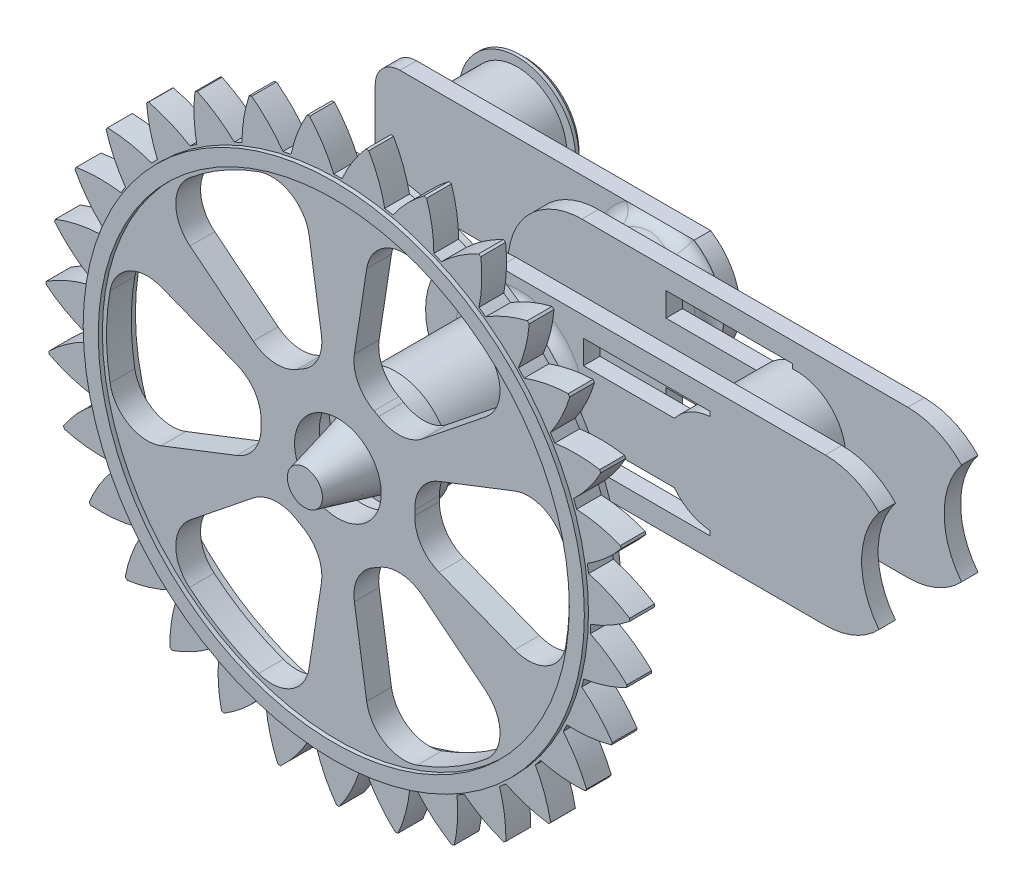
from build123d import *

# Parameters (mm, degrees)
ESQUISSE1_W                  = 1.535660627
ESQUISSE1_H                  = 0.289581718
BOSS_EXTRU_1_DEPTH           = 0.2
ESQUISSE1_3_R                = 0.6
BOSS_EXTRU_2_DEPTH           = 1.9
ESQUISSE1_4_R                = 0.6
BOSS_EXTRU_3_DEPTH           = 0.8
R_P_TITION_LIN_AIRE1_COUNT   = 2
R_P_TITION_LIN_AIRE1_PITCH   = 1
BOSS_EXTRU_4_START           = 0.5
ESQUISSE2_R                  = 0.6
BOSS_EXTRU_4_DEPTH           = 0.5
BOSS_EXTRU_5_DEPTH           = 0.2
ESQUISSE3_3_R                = 0.6
BOSS_EXTRU_6_DEPTH           = 0.8
ESQUISSE4_R                  = 0.706244544
BOSS_EXTRU_7_DEPTH           = 0.1
CHANFREIN1_SIZE              = 0.06
CONG_1_R                     = 0.17
BOSS_EXTRU_8_DEPTH           = 0.2
BOSS_EXTRU_8_DEPTH_BACK      = 0.2
ESQUISSE5_R                  = 0.66792824
ESQUISSE5_R_2                = 0.6
ESQUISSE6_W                  = 1.29816194
ESQUISSE6_H                  = 0.8
ENL_V_MAT_EXTRU_1_DEPTH      = 2.9
ESQUISSE7_R                  = 0.6
BOSS_EXTRU_9_DEPTH           = 1.1
ESQUISSE8_R                  = 3.540504545
ESQUISSE8_R_2                = 0.524870102
BOSS_EXTRU_10_DEPTH          = 0.3
ENL_V_MAT_EXTRU_2_DEPTH      = 0.3
R_P_TITION_CIRCULAIRE1_COUNT = 31
BOSS_EXTRU_11_DEPTH          = 0.1
BOSS_EXTRU_11_DEPTH_BACK     = 0.35
ESQUISSE10_R                 = 3.03621513
ESQUISSE10_R_2               = 2.853759062
ESQUISSE11_R                 = 0.387270858
BOSS_EXTRU_12_DEPTH          = 0.7
BOSS_EXTRU_12_DRAFT          = -14


with BuildPart() as part:
    # Esquisse1 → Boss.-Extru.1 (new body)
    with BuildSketch(Plane.XY):
        with BuildLine():
            ThreePointArc((1.348475238, 0.613657343), (1.052272365, 0.821028945), (0.69816194, 0.894137977))
            Line((0.69816194, 0.894137977), (-3.250686786, 0.894137977))
            ThreePointArc((-3.250686786, 0.894137977), (-4.144824763, 0), (-3.250686786, -0.894137977))
            Line((-3.250686786, -0.894137977), (0.69816194, -0.894137977))
            ThreePointArc((0.69816194, -0.894137977), (1.052272365, -0.821028945), (1.348475238, -0.613657343))
            ThreePointArc((1.348475238, -0.613657343), (1.138017125, 0), (1.348475238, 0.613657343))
        make_face()
        with Locations((-1.464318633, -0.508846585)):
            Rectangle(ESQUISSE1_W, ESQUISSE1_H, mode=Mode.SUBTRACT)
        with Locations((-1.464318633, 0.508846585)):
            Rectangle(ESQUISSE1_W, ESQUISSE1_H, mode=Mode.SUBTRACT)
    boss_extru_1 = extrude(amount=BOSS_EXTRU_1_DEPTH)

    # Esquisse1<3> → Boss.-Extru.2 (add)
    with BuildSketch(Plane.XY):
        with Locations((-3.007195488, 0)):
            Circle(ESQUISSE1_3_R)
    extrude(amount=BOSS_EXTRU_2_DEPTH)

    # Esquisse1<4> → Boss.-Extru.3 (add)
    with BuildSketch(Plane.XY):
        Circle(ESQUISSE1_4_R)
    extrude(amount=-BOSS_EXTRU_3_DEPTH)

    # Répétition linéaire1: Boss.-Extru.1 ×2
    with Locations(*[(0, 0, -i * R_P_TITION_LIN_AIRE1_PITCH) for i in range(1, R_P_TITION_LIN_AIRE1_COUNT)]):
        add(boss_extru_1)

    # Esquisse2 → Boss.-Extru.4 (add)
    with BuildSketch(Plane(origin=(0, 0, -1), x_dir=(-1, 0, 0), z_dir=(0, 0, -1)).offset(BOSS_EXTRU_4_START)):
        with Locations((3.007195488, 0)):
            Circle(ESQUISSE2_R)
    extrude(amount=-BOSS_EXTRU_4_DEPTH)

    # Esquisse3 → Boss.-Extru.5 (add)
    with BuildSketch(Plane(origin=(0, 0, -1.5), x_dir=(-1, 0, 0), z_dir=(0, 0, -1))):
        with BuildLine():
            Line((6.154794997, 0.653637444), (2.590715916, 0.653637444))
            ThreePointArc((2.590715916, 0.653637444), (2.232148952, 9.6719e-05), (2.590552792, -0.653533478))
            Line((2.590552792, -0.653533478), (6.154794997, -0.653533478))
            ThreePointArc((6.154794997, -0.653533478), (6.366927031, -0.565665513), (6.454794997, -0.353533478))
            Line((6.454794997, -0.353533478), (6.454794997, 0.353637444))
            ThreePointArc((6.454794997, 0.353637444), (6.366927031, 0.565769479), (6.154794997, 0.653637444))
        make_face()
    extrude(amount=BOSS_EXTRU_5_DEPTH)

    # Esquisse3<3> → Boss.-Extru.6 (add)
    with BuildSketch(Plane(origin=(0, 0, -1.5), x_dir=(-1, 0, 0), z_dir=(0, 0, -1))):
        with Locations((5.533341724, 0)):
            Circle(ESQUISSE3_3_R)
    extrude(amount=BOSS_EXTRU_6_DEPTH)

    # Esquisse4 → Boss.-Extru.7 (add)
    with BuildSketch(Plane(origin=(0, 0, -2.3), x_dir=(-1, 0, 0), z_dir=(0, 0, -1))):
        with Locations((5.533341724, 0)):
            Circle(ESQUISSE4_R)
    extrude(amount=BOSS_EXTRU_7_DEPTH)

    # Chanfrein1
    chanfrein1_edges = [part.edges().sort_by_distance(p)[0] for p in [
        (-4.82709718, 0, -2.4),
    ]]
    chamfer(chanfrein1_edges, length=CHANFREIN1_SIZE)

    # Congé1
    cong_1_edges = [part.edges().sort_by_distance(p)[0] for p in [
        (-2.407195488, 0, -1.5),
        (-2.407195488, 0, -1),
        (-3.607195488, 0, 0.2),
    ]]
    fillet(cong_1_edges, radius=CONG_1_R)

    # Esquisse5 → Boss.-Extru.8 (add, two sides: drawn at the far end of the back side and taken through both)
    with BuildSketch(Plane.XY.offset(1.9).offset(-BOSS_EXTRU_8_DEPTH_BACK)):
        with Locations((-3.007195488, 0)):
            Circle(ESQUISSE5_R)
        with Locations((-3.007195488, 0)):
            Circle(ESQUISSE5_R_2, mode=Mode.SUBTRACT)
    extrude(amount=BOSS_EXTRU_8_DEPTH + BOSS_EXTRU_8_DEPTH_BACK)

    # Esquisse6 → Enlèv. mat.-Extru.1 (cut)
    with BuildSketch(Plane(origin=(0, 0.894137977, 0), x_dir=(1, 0, 0), z_dir=(0, 1, 0))):
        with Locations((0.04908097, 0.4)):
            Rectangle(ESQUISSE6_W, ESQUISSE6_H)
    extrude(amount=-ENL_V_MAT_EXTRU_1_DEPTH, mode=Mode.SUBTRACT)


with BuildPart() as enl_v_mat_extru_1_piece_1:
    # of the separate pieces the step leaves, piece 1, a body of its own (enl_v_mat_extru_1_pieces)
    add(part.part.solids().sort_by_distance((-3.414206656, 0.653637444, -1.5))[0])



with BuildPart() as enl_v_mat_extru_1_piece_2:
    # of the separate pieces the step leaves, piece 2, a body of its own (enl_v_mat_extru_1_pieces)
    add(part.part.solids().sort_by_distance((0.69816194, -0.894137977, 0))[0])


with BuildPart() as enl_v_mat_extru_1_piece_1_1:
    add(enl_v_mat_extru_1_piece_1.part)

    add(enl_v_mat_extru_1_piece_2.part)  # Boss.-Extru.9 merges Enlèv. mat.-Extru.1 piece 2
    # Esquisse7 → Boss.-Extru.9 (add)
    with BuildSketch(Plane.XY.offset(0.2)):
        with Locations((-0.653226005, 0)):
            Circle(ESQUISSE7_R)
    extrude(amount=-BOSS_EXTRU_9_DEPTH)

    # Esquisse8 → Boss.-Extru.10 (add)
    with BuildSketch(Plane.XY.offset(2.1)):
        with Locations((-3.007195488, 0)):
            Circle(ESQUISSE8_R)
        with Locations((-3.007195488, 0)):
            Circle(ESQUISSE8_R_2, mode=Mode.SUBTRACT)
        with BuildLine():
            Line((-2.658268304, 2.270829461), (-2.807547224, 1.299317394))
            ThreePointArc((-2.807547224, 1.299317394), (-2.764117443, 1.023332989), (-2.568994459, 0.823381597))
            ThreePointArc((-2.568994459, 0.823381597), (-2.540832594, 0.807764227), (-2.513226623, 0.791184021))
            ThreePointArc((-2.513226623, 0.791184021), (-2.242502146, 0.722178256), (-1.981777749, 0.822559165))
            Line((-1.981777749, 0.822559165), (-1.215063079, 1.437594536))
            ThreePointArc((-1.215063079, 1.437594536), (-1.042922804, 1.791569296), (-1.207569078, 2.149091338))
            ThreePointArc((-1.207569078, 2.149091338), (-1.605656263, 2.427537146), (-2.045841, 2.633067858))
            ThreePointArc((-2.045841, 2.633067858), (-2.437787307, 2.596894693), (-2.658268304, 2.270829461))
        make_face(mode=Mode.SUBTRACT)
        with BuildLine():
            Line((-3.356122672, 2.270829461), (-3.206843752, 1.299317394))
            ThreePointArc((-3.206843752, 1.299317394), (-3.250273533, 1.023332989), (-3.445396517, 0.823381597))
            ThreePointArc((-3.445396517, 0.823381597), (-3.473558382, 0.807764227), (-3.501164353, 0.791184021))
            ThreePointArc((-3.501164353, 0.791184021), (-3.77188883, 0.722178256), (-4.032613227, 0.822559165))
            Line((-4.032613227, 0.822559165), (-4.799327897, 1.437594536))
            ThreePointArc((-4.799327897, 1.437594536), (-4.971468172, 1.791569296), (-4.806821899, 2.149091338))
            ThreePointArc((-4.806821899, 2.149091338), (-4.408734713, 2.427537146), (-3.968549976, 2.633067858))
            ThreePointArc((-3.968549976, 2.633067858), (-3.576603669, 2.596894693), (-3.356122672, 2.270829461))
        make_face(mode=Mode.SUBTRACT)
        with BuildLine():
            Line((-0.866135895, 0.833234925), (-1.782129485, 0.476758229))
            ThreePointArc((-1.782129485, 0.476758229), (-1.999424101, 0.301154732), (-2.075025594, 0.032197575))
            ThreePointArc((-2.075025594, 0.032197575), (-2.0744697, 0), (-2.075025594, -0.032197575))
            ThreePointArc((-2.075025594, -0.032197575), (-1.999424101, -0.301154732), (-1.782129485, -0.476758229))
            Line((-1.782129485, -0.476758229), (-0.866135895, -0.833234925))
            ThreePointArc((-0.866135895, -0.833234925), (-0.473514623, -0.805325396), (-0.246214589, -0.48397652))
            ThreePointArc((-0.246214589, -0.48397652), (-0.204117038, 0), (-0.246214589, 0.48397652))
            ThreePointArc((-0.246214589, 0.48397652), (-0.473514623, 0.805325396), (-0.866135895, 0.833234925))
        make_face(mode=Mode.SUBTRACT)
        with BuildLine():
            Line((-1.215063079, -1.437594536), (-1.981777749, -0.822559165))
            ThreePointArc((-1.981777749, -0.822559165), (-2.242502146, -0.722178256), (-2.513226623, -0.791184021))
            ThreePointArc((-2.513226623, -0.791184021), (-2.540832594, -0.807764227), (-2.568994459, -0.823381597))
            ThreePointArc((-2.568994459, -0.823381597), (-2.764117443, -1.023332989), (-2.807547224, -1.299317394))
            Line((-2.807547224, -1.299317394), (-2.658268304, -2.270829461))
            ThreePointArc((-2.658268304, -2.270829461), (-2.437787307, -2.596894693), (-2.045841, -2.633067858))
            ThreePointArc((-2.045841, -2.633067858), (-1.605656263, -2.427537146), (-1.207569078, -2.149091338))
            ThreePointArc((-1.207569078, -2.149091338), (-1.042922804, -1.791569296), (-1.215063079, -1.437594536))
        make_face(mode=Mode.SUBTRACT)
        with BuildLine():
            Line((-3.356122672, -2.270829461), (-3.206843752, -1.299317394))
            ThreePointArc((-3.206843752, -1.299317394), (-3.250273533, -1.023332989), (-3.445396517, -0.823381597))
            ThreePointArc((-3.445396517, -0.823381597), (-3.473558382, -0.807764227), (-3.501164353, -0.791184021))
            ThreePointArc((-3.501164353, -0.791184021), (-3.77188883, -0.722178256), (-4.032613227, -0.822559165))
            Line((-4.032613227, -0.822559165), (-4.799327897, -1.437594536))
            ThreePointArc((-4.799327897, -1.437594536), (-4.971468172, -1.791569296), (-4.806821899, -2.149091338))
            ThreePointArc((-4.806821899, -2.149091338), (-4.408734713, -2.427537146), (-3.968549976, -2.633067858))
            ThreePointArc((-3.968549976, -2.633067858), (-3.576603669, -2.596894693), (-3.356122672, -2.270829461))
        make_face(mode=Mode.SUBTRACT)
        with BuildLine():
            Line((-5.148255081, -0.833234925), (-4.232261491, -0.476758229))
            ThreePointArc((-4.232261491, -0.476758229), (-4.014966875, -0.301154732), (-3.939365382, -0.032197575))
            ThreePointArc((-3.939365382, -0.032197575), (-3.939921276, 0), (-3.939365382, 0.032197575))
            ThreePointArc((-3.939365382, 0.032197575), (-4.014966875, 0.301154732), (-4.232261491, 0.476758229))
            Line((-4.232261491, 0.476758229), (-5.148255081, 0.833234925))
            ThreePointArc((-5.148255081, 0.833234925), (-5.540876353, 0.805325396), (-5.768176387, 0.48397652))
            ThreePointArc((-5.768176387, 0.48397652), (-5.810273938, 0), (-5.768176387, -0.48397652))
            ThreePointArc((-5.768176387, -0.48397652), (-5.540876353, -0.805325396), (-5.148255081, -0.833234925))
        make_face(mode=Mode.SUBTRACT)
    extrude(amount=BOSS_EXTRU_10_DEPTH)

    # Esquisse9 → Enlèv. mat.-Extru.2 (cut)
    with BuildSketch(Plane.XY.offset(2.4)):
        with BuildLine():
            ThreePointArc((-2.559505168, 3.632597019), (-3.007195488, 3.66008029), (-3.454885808, 3.632597019))
            ThreePointArc((-3.454885808, 3.632597019), (-3.227350534, 3.36891812), (-3.057548463, 3.064835699))
            ThreePointArc((-3.057548463, 3.064835699), (-3.007195488, 3.065249302), (-2.956842513, 3.064835699))
            ThreePointArc((-2.956842513, 3.064835699), (-2.787040442, 3.36891812), (-2.559505168, 3.632597019))
        make_face()
    enl_v_mat_extru_2 = extrude(amount=-ENL_V_MAT_EXTRU_2_DEPTH, mode=Mode.SUBTRACT)

    # Répétition circulaire1: Enlèv. mat.-Extru.2 ×31 about axis
    r_p_tition_circulaire1_axis = Axis((-3.007195488, 0, 2.4), (0, 0, -1))
    for i in range(1, R_P_TITION_CIRCULAIRE1_COUNT):
        add(enl_v_mat_extru_2.rotate(r_p_tition_circulaire1_axis, i * 360 / R_P_TITION_CIRCULAIRE1_COUNT), mode=Mode.SUBTRACT)

    # Esquisse10 → Boss.-Extru.11 (add, two sides: drawn at the far end of the back side and taken through both)
    with BuildSketch(Plane(origin=(0, 0, 2.1), x_dir=(-1, 0, 0), z_dir=(0, 0, -1)).offset(-BOSS_EXTRU_11_DEPTH_BACK)):
        with Locations((3.007195488, 0)):
            Circle(ESQUISSE10_R)
        with Locations((3.007195488, 0)):
            Circle(ESQUISSE10_R_2, mode=Mode.SUBTRACT)
    extrude(amount=BOSS_EXTRU_11_DEPTH + BOSS_EXTRU_11_DEPTH_BACK)


with BuildPart() as body_2:
    # Esquisse11 → Boss.-Extru.12 (with draft: the straight prism first)
    with BuildSketch(Plane(origin=(0, 0, 2.1), x_dir=(-1, 0, 0), z_dir=(0, 0, -1))):
        with Locations((3.007195488, 0)):
            Circle(ESQUISSE11_R)
    extrude(amount=-BOSS_EXTRU_12_DEPTH)
    # Boss.-Extru.12: the draft: its side faces are tilted about the plane it starts from
    boss_extru_12_sides = [body_2.faces().sort_by_distance(p)[0] for p in [
        (-2.61992463, 0, 2.45),
    ]]
    draft(boss_extru_12_sides, Plane(origin=(0, 0, 2.1), x_dir=(-1, 0, 0), z_dir=(0, 0, -1)), BOSS_EXTRU_12_DRAFT)


solid = Compound([enl_v_mat_extru_1_piece_1_1.part, body_2.part])
